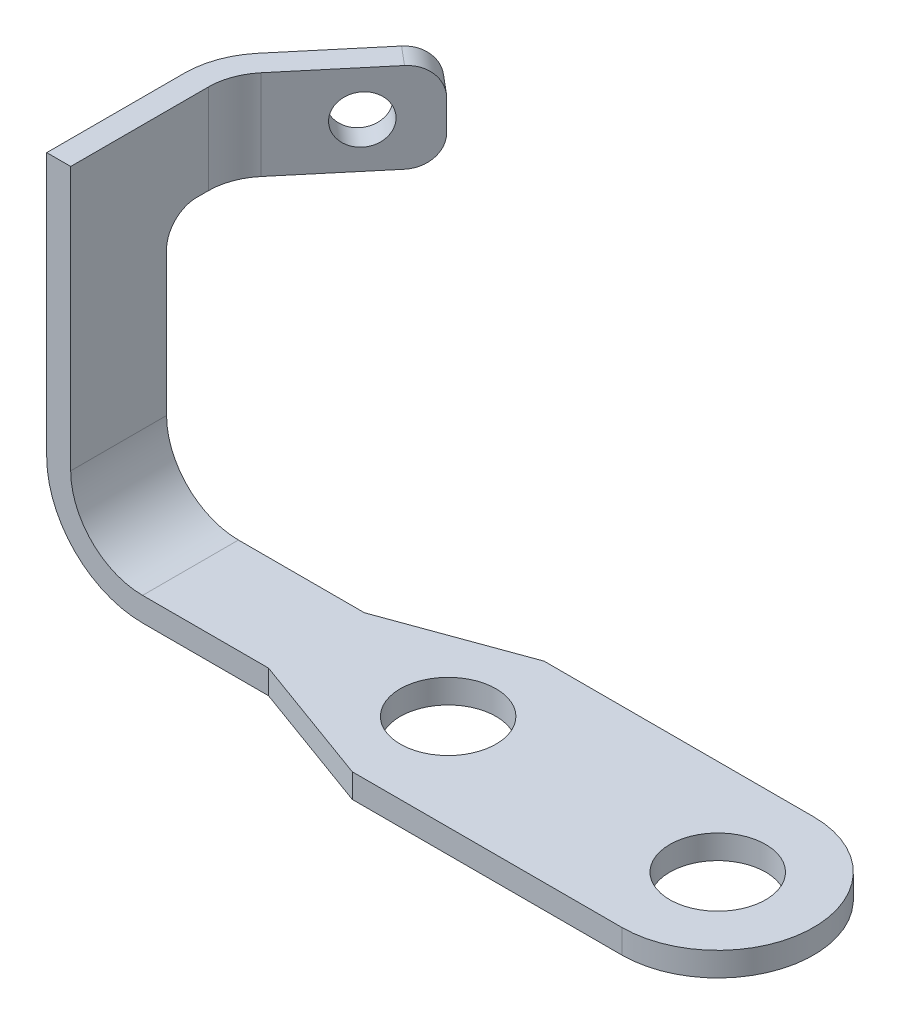
from build123d import *

# Parameters (mm, degrees)
EXTRUDE_THIN1_DEPTH     = 16
SKETCH2_R               = 20
SKETCH2_R_2             = 16
CUT_EXTRUDE_THIN1_DEPTH = 10
BOSS_EXTRUDE1_DEPTH     = 4
SKETCH2_6_R             = 8
CUT_EXTRUDE1_DEPTH      = 4
EXTRUDE_THIN2_DEPTH     = 15
FILLET1_R               = 5
FILLET2_R               = 5
SKETCH5_R               = 4
CUT_EXTRUDE2_DEPTH      = 15


with BuildPart() as part:
    # Sketch1 → Extrude-Thin1 (new body)
    with BuildSketch(Plane.XY):
        with BuildLine():
            Line((0, 0), (-104, 0))
            ThreePointArc((-104, 0), (-115.313708499, 4.686291501), (-120, 16))
            Line((-120, 16), (-120, 60))
            Line((-120, 60), (-116, 60))
            Line((-116, 60), (-116, 16))
            ThreePointArc((-116, 16), (-112.485281374, 7.514718626), (-104, 4))
            Line((-104, 4), (0, 4))
            Line((0, 4), (0, 0))
        make_face()
    extrude(amount=EXTRUDE_THIN1_DEPTH)

    # Sketch2 → Cut-Extrude-Thin1 (cut)
    with BuildSketch(Plane(origin=(0, 4, 0), x_dir=(1, 0, 0), z_dir=(0, 1, 0))):
        with Locations((-16, -8)):
            Circle(SKETCH2_R)
        with Locations((-16, -8)):
            Circle(SKETCH2_R_2, mode=Mode.SUBTRACT)
    extrude(amount=-CUT_EXTRUDE_THIN1_DEPTH, mode=Mode.SUBTRACT)


with BuildPart() as cut_extrude_thin1_piece_1:
    # of the separate pieces the step leaves, piece 1, a body of its own (cut_extrude_thin1_pieces)
    add(part.part.solids().sort_by_distance((-104, 4, 0))[0])



with BuildPart() as cut_extrude_thin1_piece_2:
    # of the separate pieces the step leaves, piece 2, a body of its own (cut_extrude_thin1_pieces)
    add(part.part.solids().sort_by_distance((-29.856406461, 4, 0))[0])


with BuildPart() as cut_extrude_thin1_piece_1_1:
    add(cut_extrude_thin1_piece_1.part)

    add(cut_extrude_thin1_piece_2.part)  # Boss-Extrude1 merges Cut-Extrude-Thin1 piece 2
    # Sketch2<5> → Boss-Extrude1 (add)
    with BuildSketch(Plane(origin=(0, 4, 0), x_dir=(1, 0, 0), z_dir=(0, 1, 0))):
        with BuildLine():
            Line((-82.979819356, 0), (-61, 0))
            ThreePointArc((-61, 0), (-53, -8), (-61, -16))
            Line((-61, -16), (-82.979819356, -16))
            Line((-82.979819356, -16), (-61, -24))
            Line((-61, -24), (-16, -24))
            ThreePointArc((-16, -24), (-8, -21.856406461), (-2.143593539, -16))
            Line((-2.143593539, -16), (-16.000000062, -16))
            ThreePointArc((-16.000000062, -16), (-24, -7.999999969), (-16, 0))
            Line((-16, 0), (-2.143593539, 0))
            ThreePointArc((-2.143593539, 0), (-8, 5.856406461), (-16, 8))
            Line((-16, 8), (-61, 8))
            Line((-61, 8), (-82.979819356, 0))
        make_face()
    extrude(amount=-BOSS_EXTRUDE1_DEPTH)

    # Sketch2<6> → Cut-Extrude1 (cut)
    with BuildSketch(Plane(origin=(0, 4, 0), x_dir=(1, 0, 0), z_dir=(0, 1, 0))):
        with Locations((-61, -8)):
            Circle(SKETCH2_6_R)
        with Locations((-16, -8)):
            Circle(SKETCH2_6_R)
    extrude(amount=-CUT_EXTRUDE1_DEPTH, mode=Mode.SUBTRACT)

    # Sketch3 → Extrude-Thin2 (add)
    with BuildSketch(Plane(origin=(0, 60, 0), x_dir=(1, 0, 0), z_dir=(0, 1, 0))):
        with BuildLine():
            Line((-116, 0), (-116, 7))
            ThreePointArc((-116, 7), (-115.396926208, 10.420201433), (-113.660444431, 13.427876097))
            Line((-113.660444431, 13.427876097), (-99.519117018, 30.280853845))
            Line((-99.519117018, 30.280853845), (-102.583294791, 32.852004284))
            Line((-102.583294791, 32.852004284), (-116.724622204, 15.999026536))
            ThreePointArc((-116.724622204, 15.999026536), (-119.155696691, 11.788282007), (-120, 7))
            Line((-120, 7), (-120, 0))
            Line((-120, 0), (-116, 0))
        make_face()
    extrude(amount=-EXTRUDE_THIN2_DEPTH)

    # Fillet1
    fillet1_edges = [cut_extrude_thin1_piece_1_1.edges().sort_by_distance(p)[0] for p in [
        (-118, 45, 0),
    ]]
    fillet(fillet1_edges, radius=FILLET1_R)

    # Fillet2
    fillet2_edges = [cut_extrude_thin1_piece_1_1.edges().sort_by_distance(p)[0] for p in [
        (-101.051205904, 45, -31.566429065),
        (-101.051205904, 60, -31.566429065),
    ]]
    fillet(fillet2_edges, radius=FILLET2_R)

    # Sketch5 → Cut-Extrude2 (cut)
    with BuildSketch(Plane(origin=(-73.310624983, 0, -61.514918385), x_dir=(0.6427876096865427, 0, -0.7660444431189752), z_dir=(0.7660444431189752, 0, 0.6427876096865427))):
        with Locations((-50.773175525, 52.5)):
            Circle(SKETCH5_R)
    extrude(amount=-CUT_EXTRUDE2_DEPTH, mode=Mode.SUBTRACT)


solid = cut_extrude_thin1_piece_1_1.part
